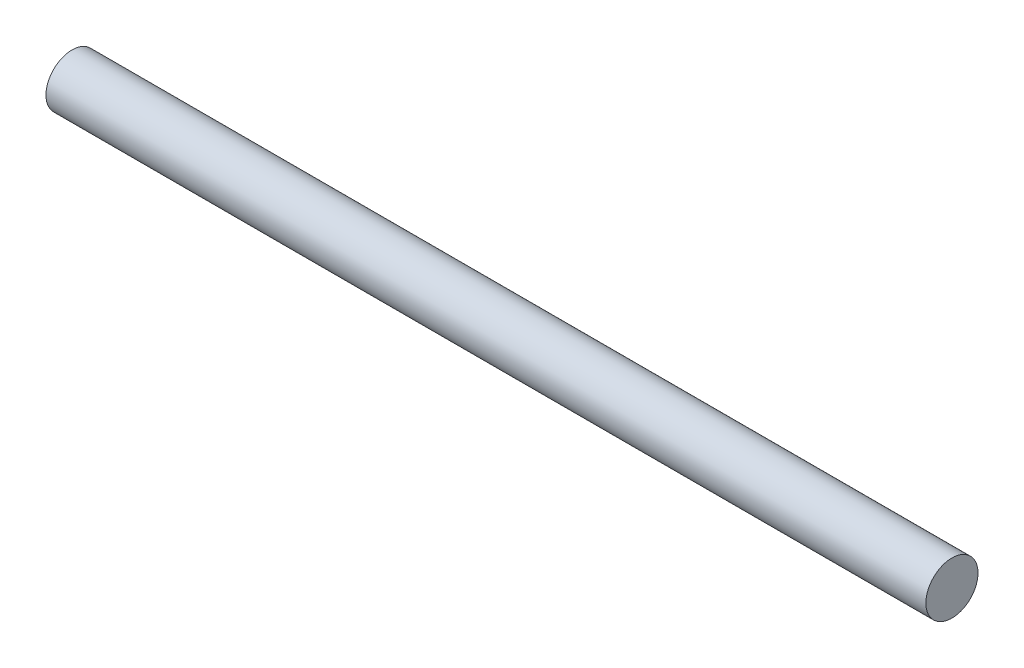
from build123d import *

# Parameters (mm, degrees)
SKETCH1_R           = 4
BOSS_EXTRUDE1_DEPTH = 135


with BuildPart() as part:
    # Sketch1 → Boss-Extrude1 (new body)
    with BuildSketch(Plane(origin=(0, 0, 0), x_dir=(0, 0, -1), z_dir=(1, 0, 0))):
        Circle(SKETCH1_R)
    extrude(amount=BOSS_EXTRUDE1_DEPTH)


solid = part.part
